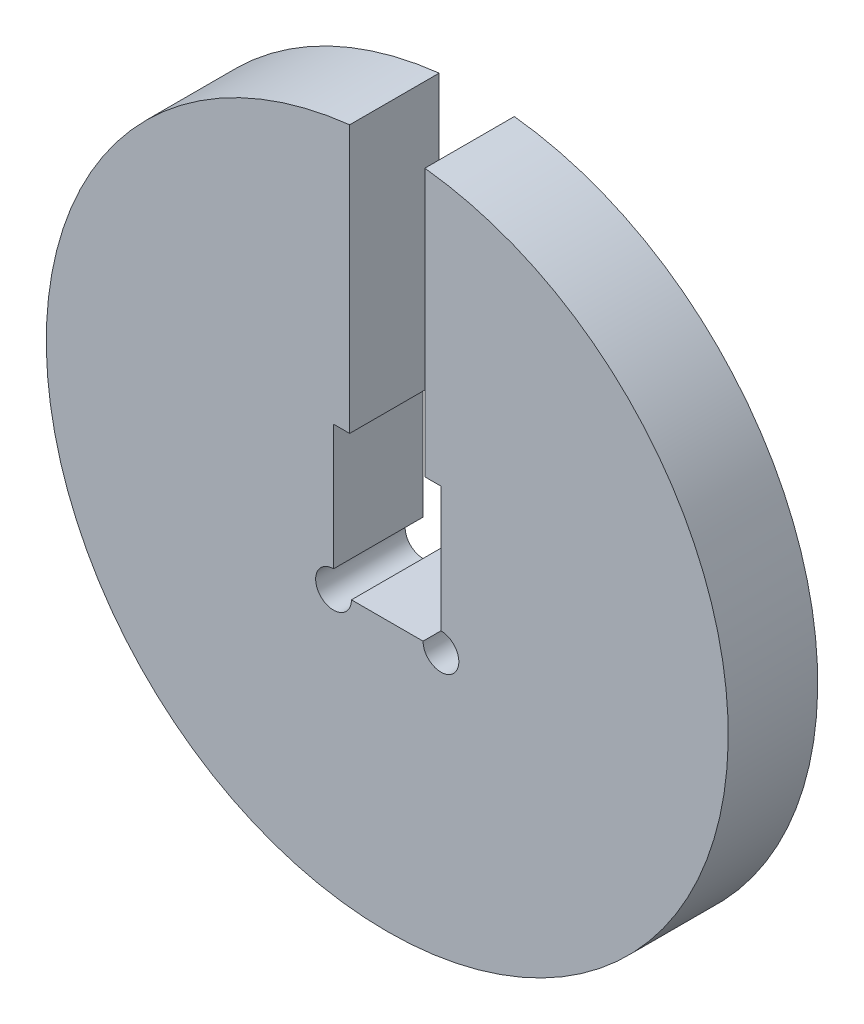
from build123d import *

# Parameters (mm, degrees)
SKETCH1_R           = 9.525
SKETCH1_W           = 3
SKETCH1_H           = 4
BOSS_EXTRUDE1_DEPTH = 2.5
SKETCH2_R           = 0.5
SKETCH2_W           = 2.1
SKETCH2_H           = 7.525
CUT_EXTRUDE1_DEPTH  = 14.700410578


with BuildPart() as part:
    # Sketch1 → Boss-Extrude1 (new body)
    with BuildSketch(Plane.XY):
        Circle(SKETCH1_R)
        Rectangle(SKETCH1_W, SKETCH1_H, mode=Mode.SUBTRACT)
    extrude(amount=BOSS_EXTRUDE1_DEPTH)

    # Sketch2 → Cut-Extrude1 (cut, through all)
    with BuildSketch(Plane.XY.offset(2.5)):
        with Locations((-1.5, -2)):
            Circle(SKETCH2_R)
        with Locations((1.5, -2)):
            Circle(SKETCH2_R)
        with Locations((0, 5.7625)):
            Rectangle(SKETCH2_W, SKETCH2_H)
    extrude(amount=-CUT_EXTRUDE1_DEPTH, mode=Mode.SUBTRACT)


solid = part.part
